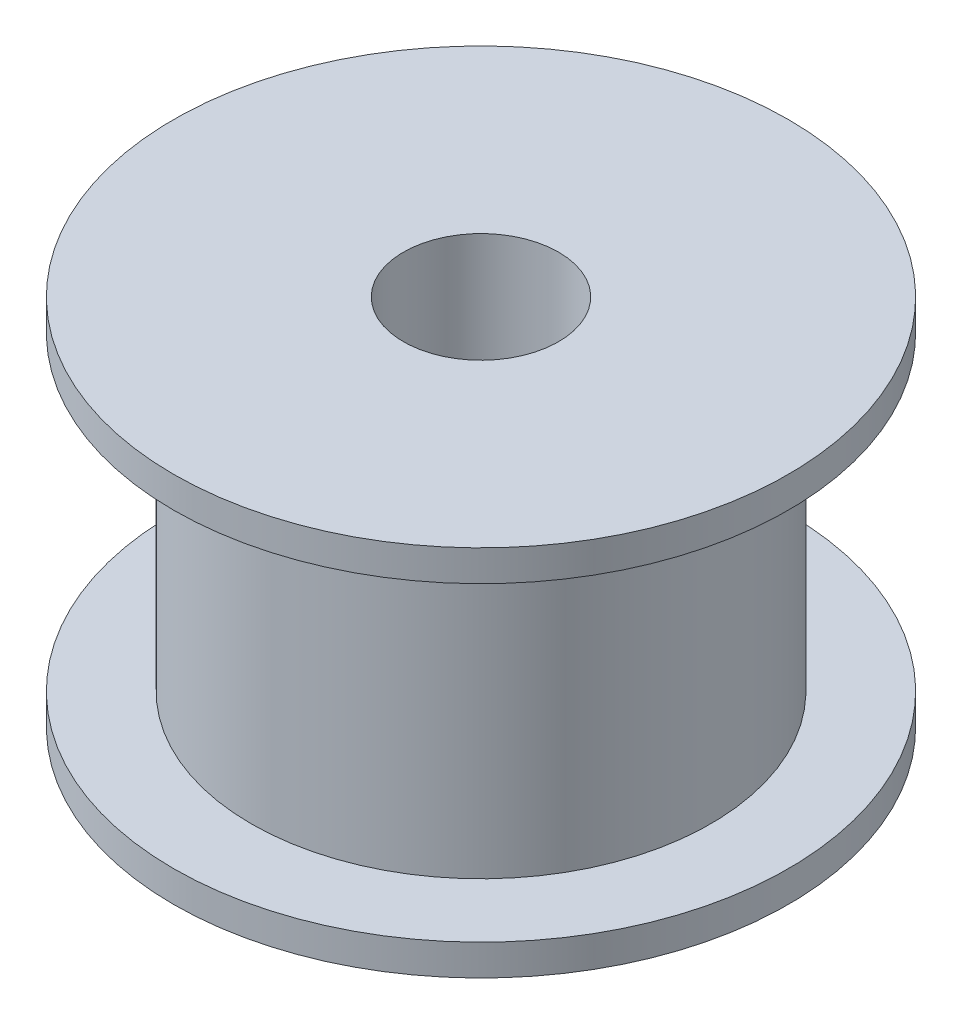
from build123d import *


with BuildPart() as part:
    # 草图2 → 旋转1 (revolve)
    with BuildSketch(Plane.XY, mode=Mode.PRIVATE) as revolve_1_sk:
        Polygon((2.5, -6), (9.9, -6), (9.9, -5), (7.4, -5), (7.4, 5), (9.9, 5), (9.9, 6), (2.5, 6), align=None)
    revolve(revolve_1_sk.sketch.rotate(Axis((0, -6, 0), (0, 1, 0)), 90), axis=Axis((0, -6, 0), (0, 1, 0)))


solid = part.part
